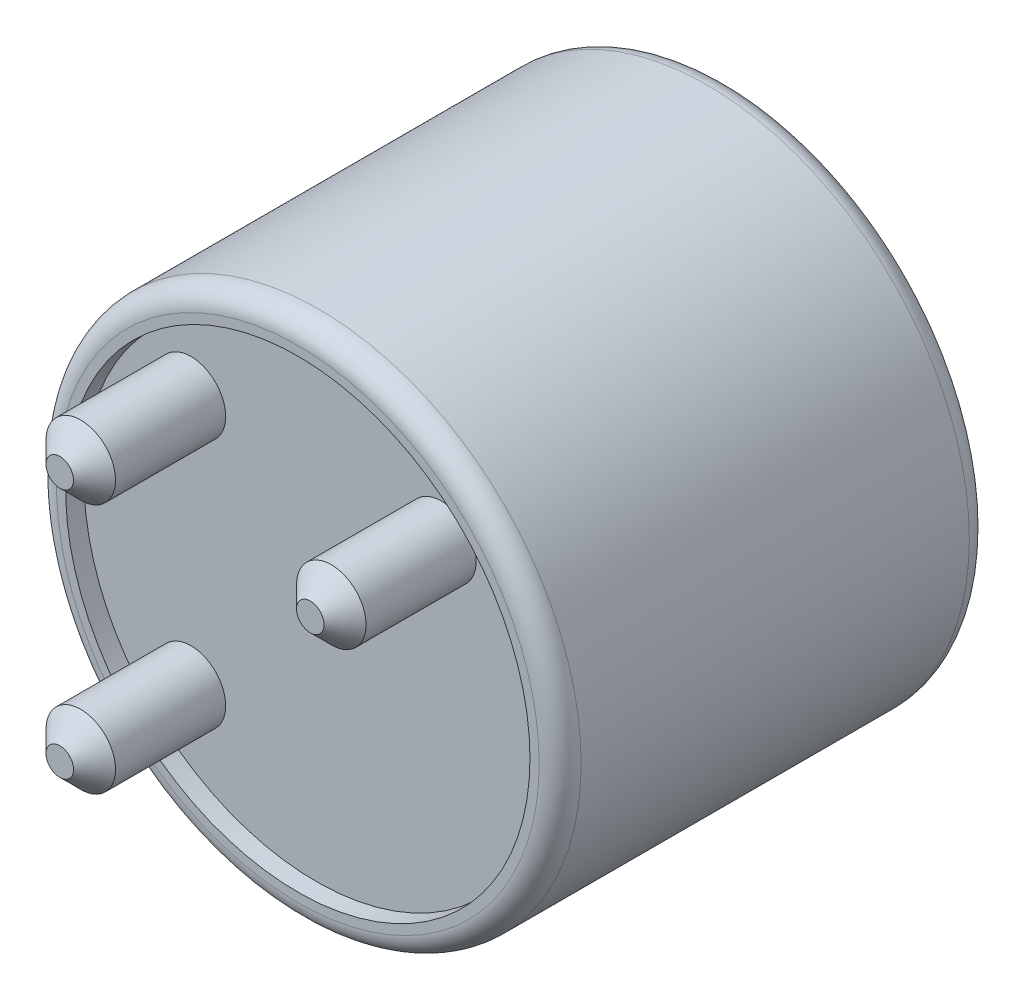
from build123d import *

# Parameters (mm, degrees)
SKETCH_1_R          = 10
EXTRUDE_1_DEPTH     = 16.4
SKETCH_2_R          = 8.85
CUT_EXTRUDE_1_DEPTH = 0.7
SKETCH_3_R          = 1.325
EXTRUDE_2_DEPTH     = 5
CHAMFER_1_SIZE      = 0.8
SKETCH_4_R          = 8.05
CUT_EXTRUDE_2_DEPTH = 0.4
FILLET_1_R          = 0.8
SKETCH_5_R          = 7
EXTRUDE_3_DEPTH     = 0.2


with BuildPart() as part:
    # Эскиз1 → Бобышка-Вытянуть1 (new body)
    with BuildSketch(Plane.XY):
        Circle(SKETCH_1_R)
    extrude(amount=EXTRUDE_1_DEPTH)

    # Эскиз2 → Вырез-Вытянуть1 (cut)
    with BuildSketch(Plane.XY.offset(16.4)):
        Circle(SKETCH_2_R)
    extrude(amount=-CUT_EXTRUDE_1_DEPTH, mode=Mode.SUBTRACT)

    # Эскиз3 → Бобышка-Вытянуть2 (add)
    with BuildSketch(Plane.XY.offset(15.7)):
        with Locations((-4.775, 4.775)):
            Circle(SKETCH_3_R)
        with Locations((-4.775, -4.775)):
            Circle(SKETCH_3_R)
        with Locations((4.775, 4.775)):
            Circle(SKETCH_3_R)
    extrude(amount=EXTRUDE_2_DEPTH)

    # Фаска1
    chamfer_1_edges = [part.edges().sort_by_distance(p)[0] for p in [
        (-6.1, 4.775, 20.7),
        (-6.1, -4.775, 20.7),
        (3.45, 4.775, 20.7),
    ]]
    chamfer(chamfer_1_edges, length=CHAMFER_1_SIZE)

    # Эскиз4 → Вырез-Вытянуть2 (cut)
    with BuildSketch(Plane(origin=(0, 0, 0), x_dir=(-1, 0, 0), z_dir=(0, 0, -1))):
        Circle(SKETCH_4_R)
    extrude(amount=-CUT_EXTRUDE_2_DEPTH, mode=Mode.SUBTRACT)

    # Скругление1
    fillet_1_edges = [part.edges().sort_by_distance(p)[0] for p in [
        (-10, 0, 0),
        (-10, 0, 16.4),
    ]]
    fillet(fillet_1_edges, radius=FILLET_1_R)

    # Эскиз5 → Бобышка-Вытянуть3 (add)
    with BuildSketch(Plane(origin=(0, 0, 0.4), x_dir=(-1, 0, 0), z_dir=(0, 0, -1))):
        Circle(SKETCH_5_R)
    extrude(amount=EXTRUDE_3_DEPTH)


solid = part.part
